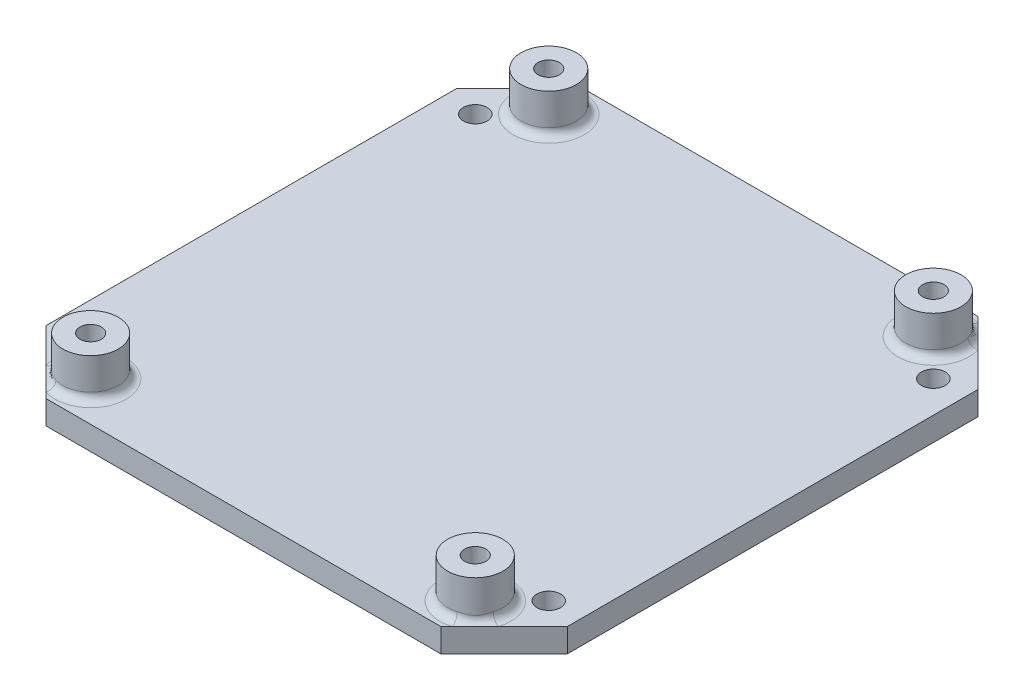
from build123d import *

# Parameters (mm, degrees)
SKETCH_1_W      = 66
SKETCH_1_H      = 68
SKETCH_1_R      = 1.5
SKETCH_1_R_2    = 3
EXTRUDE_1_DEPTH = 3
SKETCH_2_R      = 3.5
SKETCH_2_R_2    = 1.35
EXTRUDE_2_DEPTH = 5
CHAMFER_1_SIZE  = 8
FILLET_2_R      = 1


with BuildPart() as part:
    # 草图1 → 凸台-拉伸1 (new body)
    with BuildSketch(Plane(origin=(0, 0, 0), x_dir=(1, 0, 0), z_dir=(0, 1, 0))):
        Rectangle(SKETCH_1_W, SKETCH_1_H)
        with Locations(Location((-29, 24.35, 0), (0, 0, 270))):
            Circle(SKETCH_1_R, mode=Mode.SUBTRACT)
        with Locations(Location((29, 24.35, 0), (0, 0, 270))):
            Circle(SKETCH_1_R, mode=Mode.SUBTRACT)
        with Locations(Location((29, -24.35, 0), (0, 0, 270))):
            Circle(SKETCH_1_R, mode=Mode.SUBTRACT)
        with Locations(Location((-29, -24.35, 0), (0, 0, 270))):
            Circle(SKETCH_1_R, mode=Mode.SUBTRACT)
        with Locations(Location((-24.35, 29, 0), (0, 0, 270))):
            Circle(SKETCH_1_R_2, mode=Mode.SUBTRACT)
        with Locations(Location((24.35, 29, 0), (0, 0, 270))):
            Circle(SKETCH_1_R_2, mode=Mode.SUBTRACT)
        with Locations(Location((-24.35, -29, 0), (0, 0, 270))):
            Circle(SKETCH_1_R_2, mode=Mode.SUBTRACT)
        with Locations(Location((24.35, -29, 0), (0, 0, 270))):
            Circle(SKETCH_1_R_2, mode=Mode.SUBTRACT)
    extrude(amount=EXTRUDE_1_DEPTH)

    # 草图2 → 凸台-拉伸2 (add)
    # profile 1 of 4: a face of its own
    with BuildSketch(Plane(origin=(0, 3, 0), x_dir=(1, 0, 0), z_dir=(0, 1, 0))):
        with Locations(Location((-24.35, 29, 0), (0, 0, 270))):
            Circle(SKETCH_2_R)
        with Locations(Location((-24.35, 29, 0), (0, 0, 270))):
            Circle(SKETCH_2_R_2, mode=Mode.SUBTRACT)
    # profile 2 of 4: a face of its own
    with BuildSketch(Plane(origin=(0, 3, 0), x_dir=(1, 0, 0), z_dir=(0, 1, 0))):
        with Locations(Location((24.35, 29, 0), (0, 0, 90))):
            Circle(SKETCH_2_R)
        with Locations(Location((24.35, 29, 0), (0, 0, 90))):
            Circle(SKETCH_2_R_2, mode=Mode.SUBTRACT)
    # profile 3 of 4: a face of its own
    with BuildSketch(Plane(origin=(0, 3, 0), x_dir=(1, 0, 0), z_dir=(0, 1, 0))):
        with Locations(Location((24.35, -29, 0), (0, 0, 270))):
            Circle(SKETCH_2_R)
        with Locations(Location((24.35, -29, 0), (0, 0, 270))):
            Circle(SKETCH_2_R_2, mode=Mode.SUBTRACT)
    # profile 4 of 4: a face of its own
    with BuildSketch(Plane(origin=(0, 3, 0), x_dir=(1, 0, 0), z_dir=(0, 1, 0))):
        with Locations(Location((-24.35, -29, 0), (0, 0, 90))):
            Circle(SKETCH_2_R)
        with Locations(Location((-24.35, -29, 0), (0, 0, 90))):
            Circle(SKETCH_2_R_2, mode=Mode.SUBTRACT)
    extrude(amount=EXTRUDE_2_DEPTH)

    # 倒角1
    chamfer_1_edges = [part.edges().sort_by_distance(p)[0] for p in [
        (-33, 1.5, -34),
        (33, 1.5, -34),
        (33, 1.5, 34),
        (-33, 1.5, 34),
    ]]
    chamfer(chamfer_1_edges, length=CHAMFER_1_SIZE)

    # 圆角2
    fillet_2_edges = [part.edges().sort_by_distance(p)[0] for p in [
        (-24.35, 3, 32.5),
        (24.35, 3, 25.5),
        (24.35, 3, -25.5),
        (-24.35, 3, -32.5),
    ]]
    fillet(fillet_2_edges, radius=FILLET_2_R)


solid = part.part
